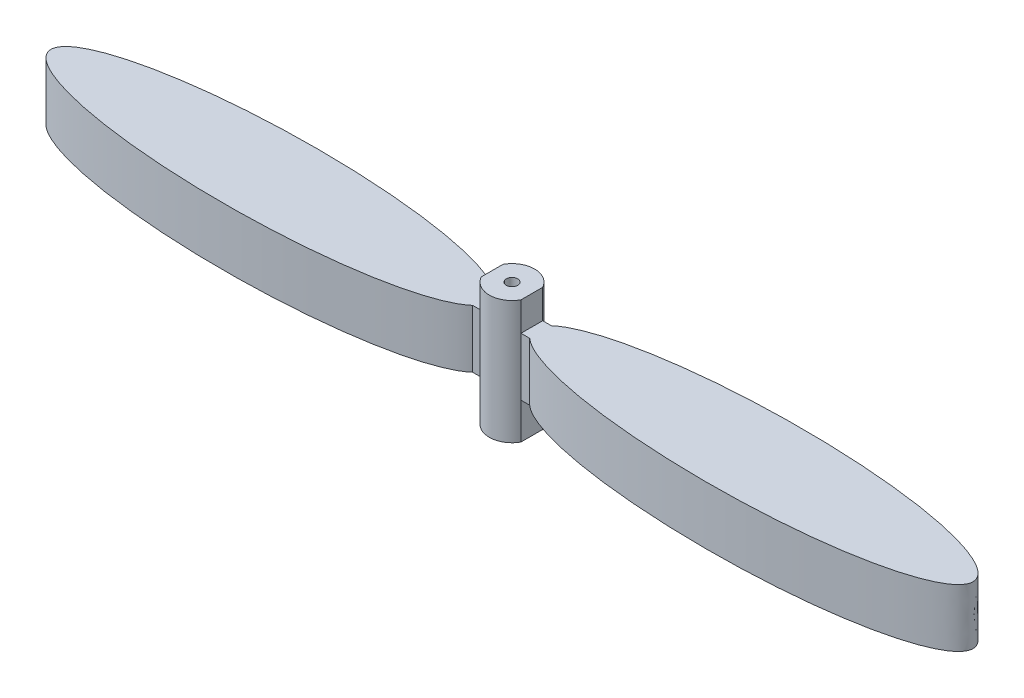
from build123d import *

# Parameters (mm, degrees)
SKETCH1_R           = 1.575
BOSS_EXTRUDE1_DEPTH = 34
SKETCH2_W           = 121.76707195
SKETCH2_H           = 10
SKETCH2_H_2         = 8
CUT_EXTRUDE1_DEPTH  = 17


with BuildPart() as part:
    # Sketch1 → Boss-Extrude1 (new body)
    with BuildSketch(Plane(origin=(0, 0, 0), x_dir=(1, 0, 0), z_dir=(0, 1, 0))):
        with BuildLine():
            Line((-5.48292805, -3), (-7.882985095, -3))
            add(Edge.make_bspline(
                [(-7.882985095, 3), (-28.237113645, 21.440777478), (-100.971837145, 10.720388739), (-173.706560645, 0), (-100.971837145, -10.720388739), (-28.237113645, -21.440777478), (-7.882985095, -3)],
                knots=[0.232868178, 0.232868178, 0.232868178, 2.172017828, 2.172017828, 4.111167479, 4.111167479, 6.050317129, 6.050317129, 6.050317129], degree=2, weights=[1, 0.565650201, 1, 0.565650201, 1, 0.565650201, 1]))
            Line((-7.882985095, 3), (-5.48292805, 3))
            ThreePointArc((-5.48292805, 3), (0, 6.25), (5.48292805, 3))
            Line((5.48292805, 3), (7.882985095, 3))
            add(Edge.make_bspline(
                [(7.882985095, -3), (28.237113645, -21.440777478), (100.971837145, -10.720388739), (173.706560645, 0), (100.971837145, 10.720388739), (28.237113645, 21.440777478), (7.882985095, 3)],
                knots=[3.374460832, 3.374460832, 3.374460832, 5.313610482, 5.313610482, 7.252760132, 7.252760132, 9.191909783, 9.191909783, 9.191909783], degree=2, weights=[1, 0.565650201, 1, 0.565650201, 1, 0.565650201, 1]))
            Line((7.882985095, -3), (5.48292805, -3))
            ThreePointArc((5.48292805, -3), (0, -6.25), (-5.48292805, -3))
        make_face()
        with Locations(Location((0, 0, 0), (0, 0, 270))):
            Circle(SKETCH1_R, mode=Mode.SUBTRACT)
    extrude(amount=BOSS_EXTRUDE1_DEPTH)

    # Sketch2 → Cut-Extrude1 (cut, symmetric)
    with BuildSketch(Plane.XY):
        with Locations((-66.366464025, 5)):
            Rectangle(SKETCH2_W, SKETCH2_H)
        with Locations((-66.366464025, 30)):
            Rectangle(SKETCH2_W, SKETCH2_H_2)
        with Locations((66.366464025, 30)):
            Rectangle(SKETCH2_W, SKETCH2_H_2)
        with Locations((66.366464025, 5)):
            Rectangle(SKETCH2_W, SKETCH2_H)
    extrude(amount=CUT_EXTRUDE1_DEPTH, both=True, mode=Mode.SUBTRACT)


solid = part.part
